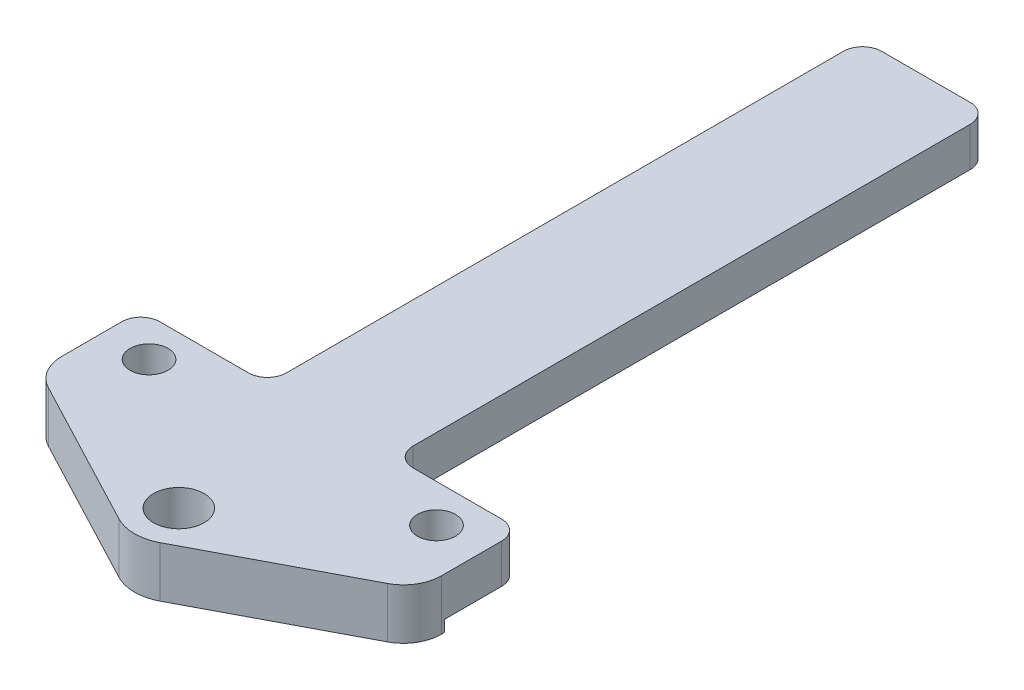
from build123d import *

# Parameters (mm, degrees)
ESBO_O1_R                         = 2
ESBO_O1_R_2                       = 1.5
RESSALTO_EXTRUS_O1_DEPTH          = 2
CORTE_EXTRUS_O4_REACH             = 64.33
ESBO_O4_W                         = 53
ESBO_O4_H                         = 0.9
CORTE_EXTRUS_O4_DIRECTION_2_REACH = 64.33
FILETE2_R                         = 1.5


with BuildPart() as part:
    # Esboço1 → Ressalto-extrusão1 (new, symmetric)
    with BuildSketch(Plane(origin=(0, 0, 0), x_dir=(1, 0, 0), z_dir=(0, 1, 0))):
        with BuildLine():
            Line((-13.5, 12), (-5, 12))
            Line((-5, 12), (-5, 59))
            Line((-5, 59), (5, 59))
            Line((5, 59), (5, 12))
            Line((5, 12), (13.5, 12))
            ThreePointArc((13.5, 12), (14.560660172, 11.560660172), (15, 10.5))
            Line((15, 10.5), (15, 5.746125079))
            ThreePointArc((15, 5.746125079), (14.568000959, 4.195199202), (13.396419283, 3.090938987))
            Line((13.396419283, 3.090938987), (1.62915583, -3.097717108))
            ThreePointArc((1.62915583, -3.097717108), (0, -3.5), (-1.62915583, -3.097717108))
            Line((-1.62915583, -3.097717108), (-13.396419283, 3.090938987))
            ThreePointArc((-13.396419283, 3.090938987), (-14.568000959, 4.195199202), (-15, 5.746125079))
            Line((-15, 5.746125079), (-15, 10.5))
            ThreePointArc((-15, 10.5), (-14.560660172, 11.560660172), (-13.5, 12))
        make_face()
        with Locations(Location((0, 0, 0), (0, 0, 270))):
            Circle(ESBO_O1_R, mode=Mode.SUBTRACT)
        with Locations(Location((-11.35, 9, 0), (0, 0, 270))):
            Circle(ESBO_O1_R_2, mode=Mode.SUBTRACT)
        with Locations(Location((11.35, 9, 0), (0, 0, 90))):
            Circle(ESBO_O1_R_2, mode=Mode.SUBTRACT)
    extrude(amount=RESSALTO_EXTRUS_O1_DEPTH, both=True)

    # Esboço4 → Corte-extrusão4 (cut, up to next)
    with BuildSketch(Plane.ZY.offset(5), mode=Mode.PRIVATE) as corte_extrus_o4_sk1:
        with Locations((-32.5, -1.55)):
            Rectangle(ESBO_O4_W, ESBO_O4_H)
    corte_extrus_o4_tool1 = extrude(corte_extrus_o4_sk1.sketch, amount=CORTE_EXTRUS_O4_REACH, mode=Mode.PRIVATE) & part.part
    add(corte_extrus_o4_tool1.solids().sort_by_distance((-5, -1.55, -32.5))[0], mode=Mode.SUBTRACT)

    # Esboço4 → Corte-extrusão4 direction 2 (cut, up to next)
    with BuildSketch(Plane.ZY.offset(5), mode=Mode.PRIVATE) as corte_extrus_o4_direction_2_sk1:
        with Locations((-32.5, -1.55)):
            Rectangle(ESBO_O4_W, ESBO_O4_H)
    corte_extrus_o4_direction_2_tool1 = extrude(corte_extrus_o4_direction_2_sk1.sketch, amount=-CORTE_EXTRUS_O4_DIRECTION_2_REACH, mode=Mode.PRIVATE) & part.part
    add(corte_extrus_o4_direction_2_tool1.solids().sort_by_distance((-5, -1.55, -32.5))[0], mode=Mode.SUBTRACT)

    # Filete2
    filete2_edges = [part.edges().sort_by_distance(p)[0] for p in [
        (-5, 0.45, -12),
        (-5, 0.45, -59),
        (5, 0.45, -59),
        (5, 0.45, -12),
    ]]
    fillet(filete2_edges, radius=FILETE2_R)


solid = part.part
